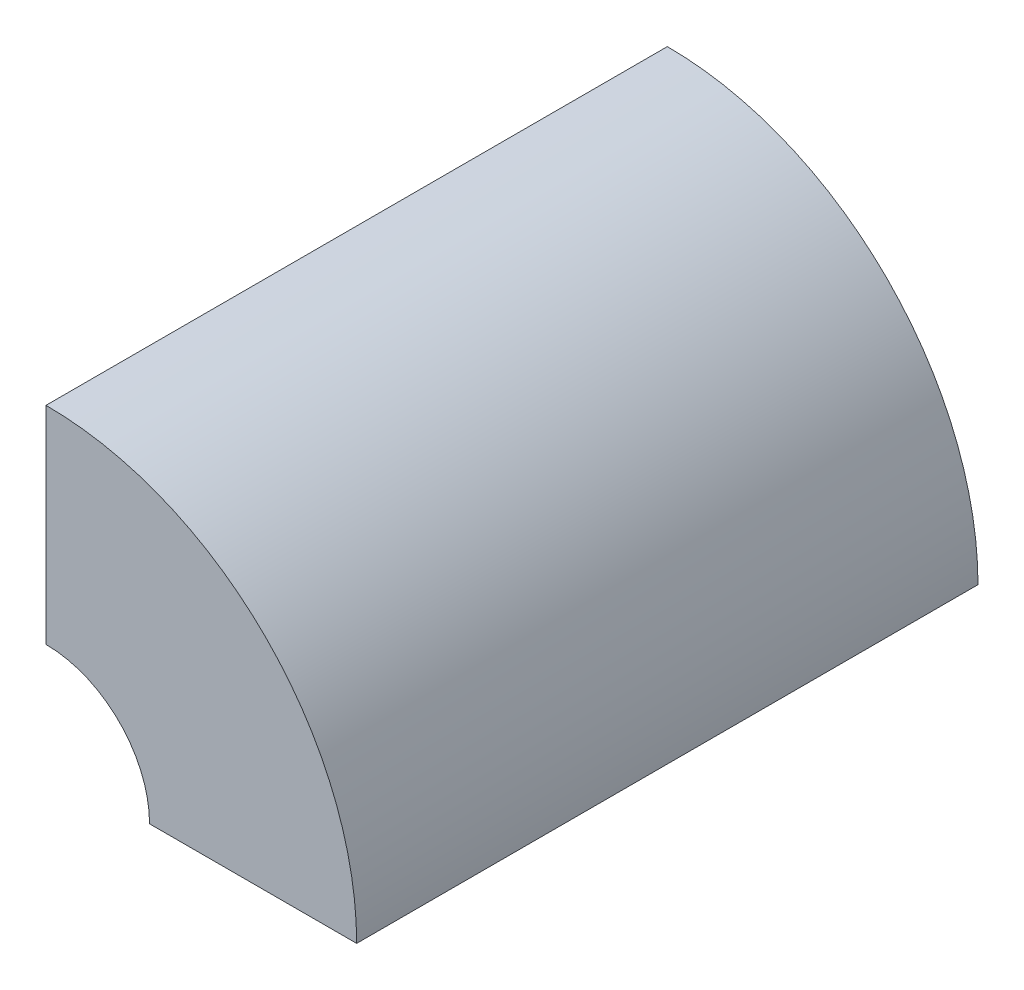
from build123d import *

# Parameters (mm, degrees)
ANNULUSPROFILE_W = 4
ANNULUSPROFILE_H = 12
REVOLUTION_ANGLE = 90


with BuildPart() as part:
    # AnnulusProfile → Revolution (revolve)
    with BuildSketch(Plane(origin=(0, 0, 0), x_dir=(1, 0, 0), z_dir=(0, 1, 0))):
        with Locations((4, -6)):
            Rectangle(ANNULUSPROFILE_W, ANNULUSPROFILE_H)
    revolve(axis=Axis((0, 0, 0), (0, 0, 1)), revolution_arc=REVOLUTION_ANGLE)


solid = part.part
